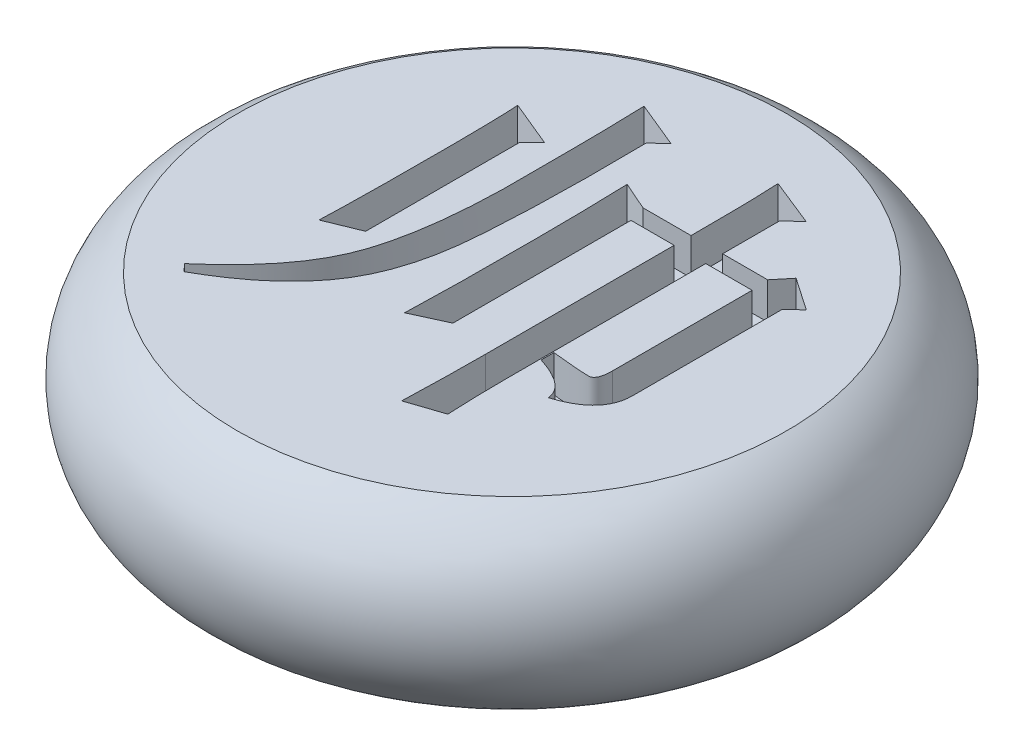
from build123d import *

# Parameters (mm, degrees)
CUT_EXTRUDE_1_DEPTH = 2


with BuildPart() as part:
    # 草图1 → 旋转1 (revolve)
    with BuildSketch(Plane.XY, mode=Mode.PRIVATE) as revolve_1_sk:
        with BuildLine():
            Line((0, 0), (15, 0))
            ThreePointArc((15, 0), (18, 5), (15, 10))
            Line((15, 10), (0, 10))
            Line((0, 10), (0, 0))
        make_face()
    revolve(revolve_1_sk.sketch.rotate(Axis((0, 13.411477292, 0), (0, -1, 0)), 90), axis=Axis((0, 13.411477292, 0), (0, -1, 0)))

    # 草图3 → 切除-拉伸1 (cut)
    with BuildSketch(Plane(origin=(0, 10, 0), x_dir=(1, 0, 0), z_dir=(0, 1, 0))):
        with BuildLine():
            add(Edge.make_bspline(
                [(-7.737435646, -2.797446042), (-7.731068719, -2.587685086), (-7.717945409, -2.155332343), (-7.696642932, -1.488687912), (-7.686423073, -0.784380082), (-7.672167654, -0.044911976), (-7.662660109, 0.731003875), (-7.657710892, 1.542239007), (-7.648610401, 2.390894981), (-7.65186825, 3.256706013), (-7.648559979, 4.1032554), (-7.65746445, 4.891980565), (-7.662502543, 5.604758223), (-7.671605944, 6.241565546), (-7.685936074, 6.8022931), (-7.695789632, 7.287287836), (-7.716164539, 7.694960994), (-7.730854842, 7.941006207), (-7.737435646, 8.051226903)],
                knots=[0, 0, 0, 0, 0.928317114, 1.913418291, 2.950357829, 4.044097515, 5.185102596, 6.382865837, 7.632702554, 8.939312537, 10.212783862, 11.377409509, 12.428421057, 13.365879284, 14.194562146, 14.909661131, 15.511561687, 16, 16, 16, 16], degree=3))
            Line((-7.737435646, 8.051226903), (-5.249207906, 7.020619026))
            Line((-5.249207906, 7.020619026), (-5.929858591, 6.349600191))
            Line((-5.929858591, 6.349600191), (-5.929858591, -2.059004261))
            Line((-5.929858591, -2.059004261), (-7.737435646, -2.797446042))
        make_face()
        with BuildLine():
            add(Edge.make_bspline(
                [(-9.352375714, -8.534817617), (-9.084525015, -8.300974918), (-8.562369969, -7.845115942), (-7.839466918, -7.133926567), (-7.190646214, -6.425865151), (-6.614868907, -5.721727451), (-6.117599742, -5.01766043), (-5.699034732, -4.312825243), (-5.35196567, -3.611575818), (-5.078196611, -2.899933759), (-4.858394528, -2.160239778), (-4.674985415, -1.371412367), (-4.513140358, -0.524594418), (-4.388643582, 0.382421036), (-4.283467988, 1.346814475), (-4.217243739, 2.370936396), (-4.169114628, 3.45422046), (-4.163132935, 4.574135062), (-4.162447067, 5.68500678), (-4.170367209, 6.74022891), (-4.177021693, 7.717319618), (-4.181368154, 8.616338485), (-4.194730299, 9.437192973), (-4.211775037, 10.179872076), (-4.226060685, 10.843485892), (-4.240662817, 11.259714785), (-4.247495577, 11.454480328)],
                knots=[0, 0, 0, 0, 1.185402125, 2.310853403, 3.379298985, 4.386389788, 5.341776688, 6.250603628, 7.117198236, 7.947562309, 8.789765669, 9.688220653, 10.647060204, 11.663458785, 12.7400909, 13.881155971, 15.084787921, 16.355264848, 17.614955996, 18.789024112, 19.873880758, 20.873094693, 21.786749924, 22.611273472, 23.350174675, 24, 24, 24, 24], degree=3))
            Line((-4.247495577, 11.454480328), (-1.759267838, 10.430293684))
            Line((-1.759267838, 10.430293684), (-2.446339755, 9.756064232))
            add(Edge.make_bspline(
                [(-2.446339755, 9.756064232), (-2.440091603, 9.296954134), (-2.427886973, 8.400166089), (-2.425054866, 7.088026543), (-2.433852361, 5.841156766), (-2.457190325, 4.659621552), (-2.487940385, 3.542189591), (-2.532130363, 2.488939398), (-2.591199959, 1.501176574), (-2.654809669, 0.574553083), (-2.745066202, -0.298269112), (-2.877247045, -1.122116359), (-3.041703355, -1.903705624), (-3.251953741, -2.638406345), (-3.493159764, -3.332378276), (-3.78089571, -3.978119394), (-4.100727381, -4.582126813), (-4.465575897, -5.142882654), (-4.871083747, -5.674414465), (-5.322135975, -6.183582916), (-5.815645595, -6.680645685), (-6.355725979, -7.162346781), (-6.944200864, -7.627281526), (-7.57898216, -8.076065119), (-8.255596092, -8.514663533), (-8.73132227, -8.785443356), (-8.973522975, -8.923302207)],
                knots=[0, 0, 0, 0, 1.560783084, 3.048705779, 4.460269439, 5.799274246, 7.065800622, 8.260132026, 9.382529971, 10.429410577, 11.417304408, 12.364078358, 13.264555336, 14.130553639, 14.960140012, 15.759842068, 16.531300228, 17.281042902, 18.03120911, 18.801912066, 19.591647171, 20.410984061, 21.260379231, 22.139595362, 23.052834729, 24, 24, 24, 24], degree=3))
            Line((-8.973522975, -8.923302207), (-9.352375714, -8.534817617))
        make_face()
        with BuildLine():
            add(Edge.make_bspline(
                [(3.152975313, 6.622502588), (3.153588126, 6.89540738), (3.154770514, 7.421962128), (3.146611659, 8.180724822), (3.140028092, 8.877422102), (3.135631354, 9.512118402), (3.122401095, 10.084693336), (3.105340851, 10.596188458), (3.091104619, 11.045807919), (3.076344341, 11.325003722), (3.069499286, 11.454480328)],
                knots=[0, 0, 0, 0, 1.355131449, 2.614651405, 3.767890675, 4.814850097, 5.76633671, 6.611718708, 7.356186779, 8, 8, 8, 8], degree=3))
            Line((3.069499286, 11.454480328), (5.641203053, 10.420661835))
            Line((5.641203053, 10.420661835), (4.87707634, 9.743221766))
            Line((4.87707634, 9.743221766), (4.87707634, 6.622502588))
            Line((4.87707634, 6.622502588), (7.336408532, 6.622502588))
            Line((7.336408532, 6.622502588), (8.036322916, 7.473315944))
            Line((8.036322916, 7.473315944), (9.811793806, 6.253281698))
            Line((9.811793806, 6.253281698), (9.131143121, 5.617579643))
            Line((9.131143121, 5.617579643), (9.131143121, -2.399329604))
            add(Edge.make_bspline(
                [(9.131143121, -2.399329604), (9.131395669, -2.546397527), (9.131885996, -2.831932311), (9.038977853, -3.246324843), (8.869656202, -3.623256102), (8.626107599, -3.965580357), (8.304608549, -4.264870746), (7.911665558, -4.529495739), (7.446925145, -4.762008048), (7.102712639, -4.875966944), (6.922239012, -4.93571659)],
                knots=[0, 0, 0, 0, 0.96219561, 1.868118553, 2.760343656, 3.656205337, 4.604451048, 5.624548914, 6.75453022, 8, 8, 8, 8], degree=3))
            add(Edge.make_bspline(
                [(6.922239012, -4.93571659), (6.909123756, -4.854277288), (6.882545497, -4.689239347), (6.76543208, -4.457080757), (6.597014494, -4.239577573), (6.375934205, -4.032062925), (6.094335298, -3.845055724), (5.760972018, -3.665348344), (5.3728269, -3.494916639), (5.089884589, -3.401790672), (4.941288669, -3.352882686)],
                knots=[0, 0, 0, 0, 0.736733597, 1.493001439, 2.301925965, 3.199030657, 4.20096543, 5.327273661, 6.596334963, 8, 8, 8, 8], degree=3))
            Line((4.941288669, -3.352882686), (4.941288669, -2.652968302))
            add(Edge.make_bspline(
                [(4.941288669, -2.652968302), (5.067580967, -2.665728809), (5.309464653, -2.690168608), (5.652829722, -2.726155562), (5.961218582, -2.754387456), (6.23180788, -2.780889296), (6.468341952, -2.800346265), (6.66736422, -2.813966281), (6.831367995, -2.818966606), (6.961738085, -2.825714194), (7.073934615, -2.817350678), (7.1666596, -2.768928995), (7.242752738, -2.694357526), (7.305466829, -2.593339306), (7.350603643, -2.463928678), (7.386512175, -2.307952974), (7.403655814, -2.123586173), (7.405861386, -1.99160248), (7.407042094, -1.920947754)],
                knots=[0, 0, 0, 0, 1.935290813, 3.70660193, 5.263620808, 6.65666223, 7.851791597, 8.881808183, 9.698291315, 10.351159825, 10.877354834, 11.388145665, 11.907465341, 12.486877492, 13.183923572, 13.987423657, 14.922609108, 16, 16, 16, 16], degree=3))
            Line((7.407042094, -1.920947754), (7.407042094, 5.70105567))
            Line((7.407042094, 5.70105567), (4.87707634, 5.70105567))
            Line((4.87707634, 5.70105567), (4.87707634, -5.12514296))
            add(Edge.make_bspline(
                [(4.87707634, -5.12514296), (4.880062675, -5.679591911), (4.886054434, -6.792034181), (4.933528892, -7.903479956), (4.957341751, -8.460973439)],
                knots=[0, 0, 0, 0, 0.996813886, 2, 2, 2, 2], degree=3))
            Line((4.957341751, -8.460973439), (3.069499286, -9.093464878))
            add(Edge.make_bspline(
                [(3.069499286, -9.093464878), (3.076173355, -8.874079729), (3.089227829, -8.444962546), (3.104114646, -7.815620094), (3.12099665, -7.214217278), (3.135029943, -6.640611688), (3.139755388, -6.093672162), (3.145931121, -5.574624741), (3.154576391, -5.083429325), (3.153498098, -4.765557311), (3.152975313, -4.61144433)],
                knots=[0, 0, 0, 0, 1.175035445, 2.298368424, 3.370154139, 4.395977557, 5.370047505, 6.298285367, 7.17496255, 8, 8, 8, 8], degree=3))
            Line((3.152975313, -4.61144433), (3.152975313, 5.70105567))
            Line((3.152975313, 5.70105567), (0.793172231, 5.70105567))
            Line((0.793172231, 5.70105567), (0.793172231, -4.020690905))
            Line((0.793172231, -4.020690905), (-1.014404824, -4.849029946))
            add(Edge.make_bspline(
                [(-1.014404824, -4.849029946), (-1.00758523, -4.672458776), (-0.993121685, -4.297972388), (-0.978711974, -3.703916925), (-0.961773948, -3.046857597), (-0.948257418, -2.325535215), (-0.943934204, -1.541021297), (-0.937399912, -0.69128389), (-0.928883861, 0.221590297), (-0.931985888, 1.178367317), (-0.928877241, 2.136214544), (-0.93744001, 3.054439424), (-0.943919928, 3.911668811), (-0.948313778, 4.707953238), (-0.961785981, 5.443188246), (-0.978767285, 6.117371114), (-0.993218695, 6.730684991), (-1.007592937, 7.119089948), (-1.014404824, 7.303153273)],
                knots=[0, 0, 0, 0, 0.697843585, 1.480043001, 2.346745801, 3.293646528, 4.329188613, 5.445032886, 6.649632591, 7.934507307, 9.223608584, 10.432434748, 11.560958345, 12.609179698, 13.577209938, 14.465039412, 15.272589231, 16, 16, 16, 16], degree=3))
            Line((-1.014404824, 7.303153273), (0.526691066, 6.622502588))
            Line((0.526691066, 6.622502588), (3.152975313, 6.622502588))
        make_face()
    extrude(amount=-CUT_EXTRUDE_1_DEPTH, mode=Mode.SUBTRACT)


solid = part.part
